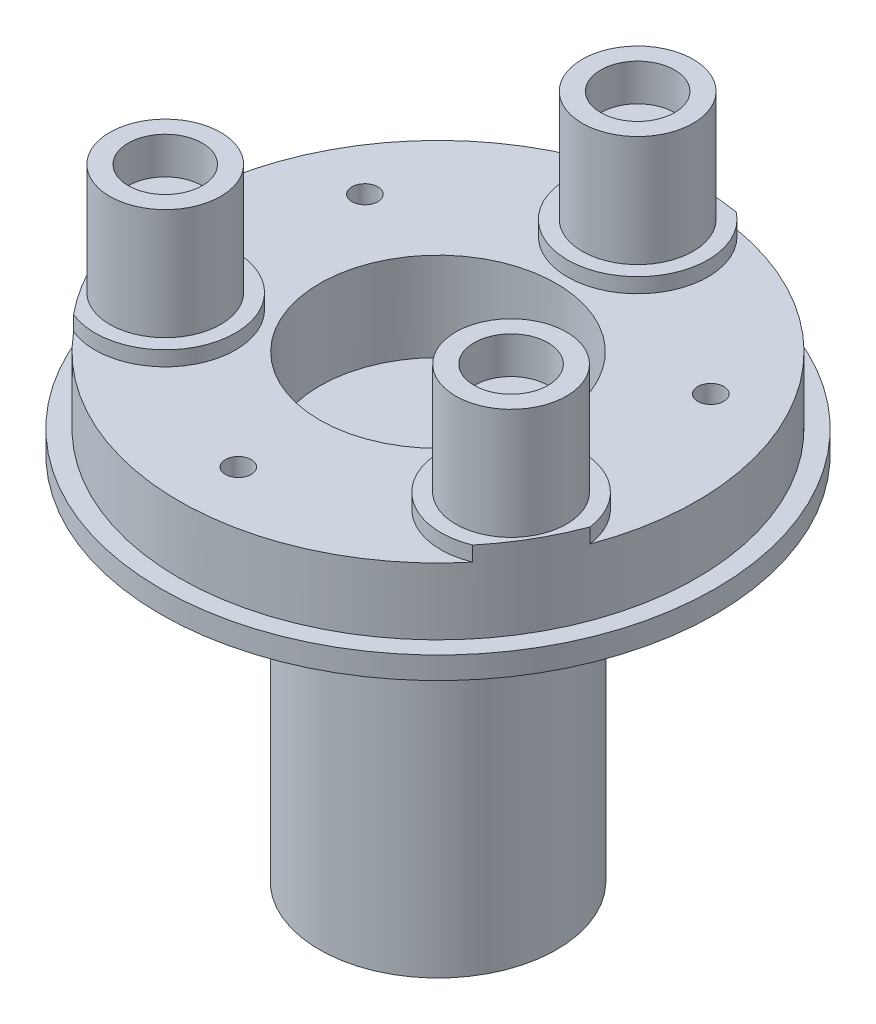
from build123d import *

# Parameters (mm, degrees)
SKETCH1_R                                     = 37.5
BOSS_EXTRUDE1_DEPTH                           = 3
SKETCH1_3_R                                   = 35
BOSS_EXTRUDE2_DEPTH                           = 12
SKETCH13_R                                    = 16
CUT_EXTRUDE6_DEPTH                            = 55.373706881
BOSS_EXTRUDE9_DEPTH                           = 2
SKETCH25_R                                    = 7.5
BOSS_EXTRUDE10_DEPTH                          = 15
SKETCH26_R                                    = 5
CUT_EXTRUDE9_DEPTH                            = 5
CBORE_FOR_M3_PAN_HEAD_MACHINE_SCREW1_AT_COUNT = 2
CBORE_FOR_M3_PAN_HEAD_MACHINE_SCREW1_AT_PITCH = 46.765371804
CBORE_FOR_M3_PAN_HEAD_MACHINE_SCREW1_2_COUNT  = 2
CBORE_FOR_M3_PAN_HEAD_MACHINE_SCREW1_2_PITCH  = 46.765371804
SKETCH29_R                                    = 1.75
CUT_EXTRUDE10_DEPTH                           = 56.691112397
SKETCH31_R                                    = 16.05
BOSS_EXTRUDE11_DEPTH                          = 50
SKETCH32_R                                    = 18
SKETCH32_R_2                                  = 16
BOSS_EXTRUDE12_DEPTH                          = 1.11


with BuildPart() as part:
    # Sketch1 → Boss-Extrude1 (new body)
    with BuildSketch(Plane(origin=(0, 0, 0), x_dir=(1, 0, 0), z_dir=(0, 1, 0))):
        Circle(SKETCH1_R)
    extrude(amount=BOSS_EXTRUDE1_DEPTH)

    # Sketch1<3> → Boss-Extrude2 (add)
    with BuildSketch(Plane(origin=(0, 0, 0), x_dir=(1, 0, 0), z_dir=(0, 1, 0))):
        Circle(SKETCH1_3_R)
    extrude(amount=BOSS_EXTRUDE2_DEPTH)

    # Sketch13 → Cut-Extrude6 (cut, through all)
    with BuildSketch(Plane(origin=(0, 12, 0), x_dir=(1, 0, 0), z_dir=(0, 1, 0))):
        Circle(SKETCH13_R)
    extrude(amount=-CUT_EXTRUDE6_DEPTH, mode=Mode.SUBTRACT)

    # Sketch24 → Boss-Extrude9 (add)
    with BuildSketch(Plane(origin=(0, 12, 0), x_dir=(1, 0, 0), z_dir=(0, 1, 0))):
        with BuildLine():
            ThreePointArc((5.813043417, 34.513888889), (0, 35), (-5.813043417, 34.513888889))
            ThreePointArc((-5.813043417, 34.513888889), (0, 17.5), (5.813043417, 34.513888889))
        make_face()
        with BuildLine():
            ThreePointArc((-26.983382853, -22.291187717), (-15.155444566, -8.75), (-32.79642627, -12.222701172))
            ThreePointArc((-32.79642627, -12.222701172), (-30.310889132, -17.5), (-26.983382853, -22.291187717))
        make_face()
        with BuildLine():
            ThreePointArc((26.983382853, -22.291187717), (30.310889132, -17.5), (32.79642627, -12.222701172))
            ThreePointArc((32.79642627, -12.222701172), (15.155444566, -8.75), (26.983382853, -22.291187717))
        make_face()
    extrude(amount=BOSS_EXTRUDE9_DEPTH)

    # Sketch25 → Boss-Extrude10 (add)
    with BuildSketch(Plane(origin=(0, 14, 0), x_dir=(1, 0, 0), z_dir=(0, 1, 0))):
        with Locations((0, 27)):
            Circle(SKETCH25_R)
        with Locations((23.382685902, -13.5)):
            Circle(SKETCH25_R)
        with Locations((-23.382685902, -13.5)):
            Circle(SKETCH25_R)
    extrude(amount=BOSS_EXTRUDE10_DEPTH)

    # Sketch26 → Cut-Extrude9 (cut)
    with BuildSketch(Plane(origin=(0, 29, 0), x_dir=(1, 0, 0), z_dir=(0, 1, 0))):
        with Locations((0, 27)):
            Circle(SKETCH26_R)
        with Locations((23.382685902, -13.5)):
            Circle(SKETCH26_R)
        with Locations((-23.382685902, -13.5)):
            Circle(SKETCH26_R)
    extrude(amount=-CUT_EXTRUDE9_DEPTH, mode=Mode.SUBTRACT)

    # Sketch28 → CBORE for M3 Pan Head Machine Screw1 (revolve, cut)
    with BuildSketch(Plane(origin=(0, 0, -27), x_dir=(0, 0, -1), z_dir=(1, 0, 0))):
        Polygon((0, 0), (0, 29), (1.8, 29), (1.8, 2.4), (3.5, 2.4), (3.5, 0.025), (3.525, 0), align=None)
    cbore_for_m3_pan_head_machine_screw1 = revolve(axis=Axis((0, -6.35, -27), (0, 1, 0)), mode=Mode.SUBTRACT)

    # CBORE for M3 Pan Head Machine Screw1 at: CBORE for M3 Pan Head Machine Screw1 ×2
    with Locations(*[Vector(-0.5000000000000369, 0, 0.8660254037844174) * (i * CBORE_FOR_M3_PAN_HEAD_MACHINE_SCREW1_AT_PITCH) for i in range(1, CBORE_FOR_M3_PAN_HEAD_MACHINE_SCREW1_AT_COUNT)]):
        add(cbore_for_m3_pan_head_machine_screw1, mode=Mode.SUBTRACT)

    # CBORE for M3 Pan Head Machine Screw1 2: CBORE for M3 Pan Head Machine Screw1 ×2
    with Locations(*[Vector(0.49999999999996353, 0, 0.8660254037844598) * (i * CBORE_FOR_M3_PAN_HEAD_MACHINE_SCREW1_2_PITCH) for i in range(1, CBORE_FOR_M3_PAN_HEAD_MACHINE_SCREW1_2_COUNT)]):
        add(cbore_for_m3_pan_head_machine_screw1, mode=Mode.SUBTRACT)

    # Sketch29 → Cut-Extrude10 (cut, through all)
    with BuildSketch(Plane(origin=(0, 12, 0), x_dir=(1, 0, 0), z_dir=(0, 1, 0))):
        with Locations((23.382685902, 13.5)):
            Circle(SKETCH29_R)
        with Locations((0, -27)):
            Circle(SKETCH29_R)
        with Locations((-23.382685902, 13.5)):
            Circle(SKETCH29_R)
    extrude(amount=-CUT_EXTRUDE10_DEPTH, mode=Mode.SUBTRACT)



with BuildPart() as body_2:
    # Sketch31 → Boss-Extrude11 (new body)
    with BuildSketch(Plane.XZ):
        Circle(SKETCH31_R)
    extrude(amount=BOSS_EXTRUDE11_DEPTH)


with BuildPart() as part_1:
    add(part.part)

    add(body_2.part)  # Boss-Extrude12 merges body 2
    # Sketch32 → Boss-Extrude12 (add)
    with BuildSketch(Plane.XZ):
        Circle(SKETCH32_R)
        Circle(SKETCH32_R_2, mode=Mode.SUBTRACT)
    extrude(amount=BOSS_EXTRUDE12_DEPTH)


solid = part_1.part
